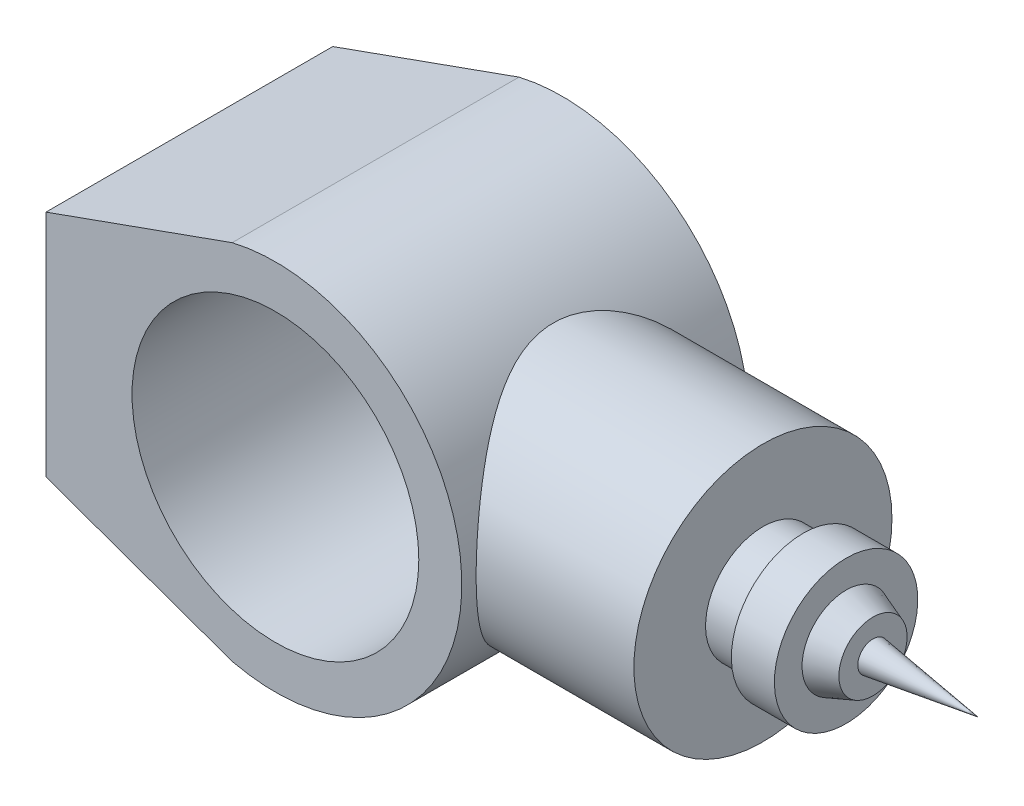
from build123d import *

# Parameters (mm, degrees)
SKETCH1_R                = 50
BOSS_EXTRUDE1_DEPTH      = 50
BOSS_EXTRUDE2_REACH      = 218.16
BOSS_EXTRUDE2_END_RADIUS = 65
SKETCH2_R                = 45


with BuildPart() as part:
    # Sketch1 → Boss-Extrude1 (new, symmetric)
    with BuildSketch(Plane.XY):
        with BuildLine():
            Line((-80, -40), (-80, 40))
            Line((-80, 40), (-15.066853128, 63.229660262))
            ThreePointArc((-15.066853128, 63.229660262), (65, 0), (-15.066853128, -63.229660262))
            Line((-15.066853128, -63.229660262), (-80, -40))
        make_face()
        Circle(SKETCH1_R, mode=Mode.SUBTRACT)
    extrude(amount=BOSS_EXTRUDE1_DEPTH, both=True)

    # Boss-Extrude2: up to this cylinder (the profile starts outside it)
    boss_extrude2_end = Plane(origin=(0, 0, 0), z_dir=(0, 0, -1)) * Cylinder(BOSS_EXTRUDE2_END_RADIUS, 567.32, mode=Mode.PRIVATE)
    # Sketch2 → Boss-Extrude2 (add, up to the surface)
    with BuildSketch(Plane(origin=(120, 0, 0), x_dir=(0, 0, -1), z_dir=(1, 0, 0)), mode=Mode.PRIVATE) as boss_extrude2_sk1:
        Circle(SKETCH2_R)
    boss_extrude2_tool1 = extrude(boss_extrude2_sk1.sketch, amount=-BOSS_EXTRUDE2_REACH, mode=Mode.PRIVATE) - boss_extrude2_end
    add(boss_extrude2_tool1.solids().sort_by_distance((120, 0, 0))[0])

    # Sketch3 → Revolve1 (revolve)
    with BuildSketch(Plane.XY, mode=Mode.PRIVATE) as revolve1_sk:
        Polygon((120, 0), (120, -20), (134, -20), (134, -25), (149, -25), (149, -15.35354432), (158.38144624, -11.89110783), (158.38144624, -5.299199989), (195, 0), align=None)
    revolve(revolve1_sk.sketch.rotate(Axis((195, 0, 0), (-1, 0, 0)), 180), axis=Axis((195, 0, 0), (-1, 0, 0)))


solid = part.part
